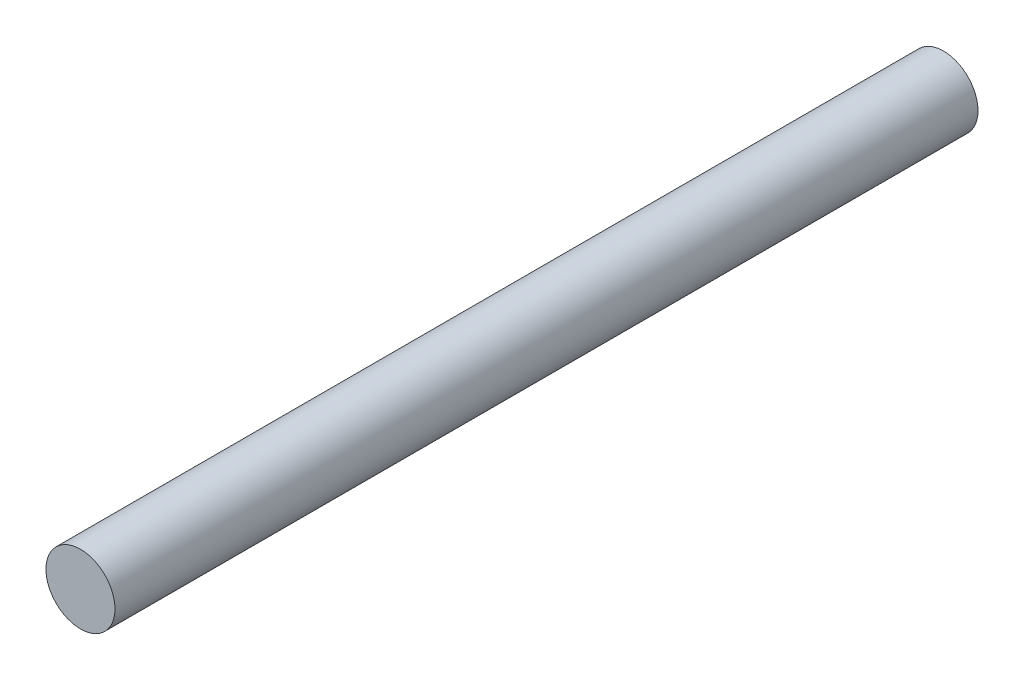
from build123d import *

# Parameters (mm, degrees)
CROQUIS1_R              = 1
SALIENTE_EXTRUIR1_DEPTH = 25


with BuildPart() as part:
    # Croquis1 → Saliente-Extruir1 (new body)
    with BuildSketch(Plane.XY):
        Circle(CROQUIS1_R)
    extrude(amount=SALIENTE_EXTRUIR1_DEPTH)


solid = part.part
